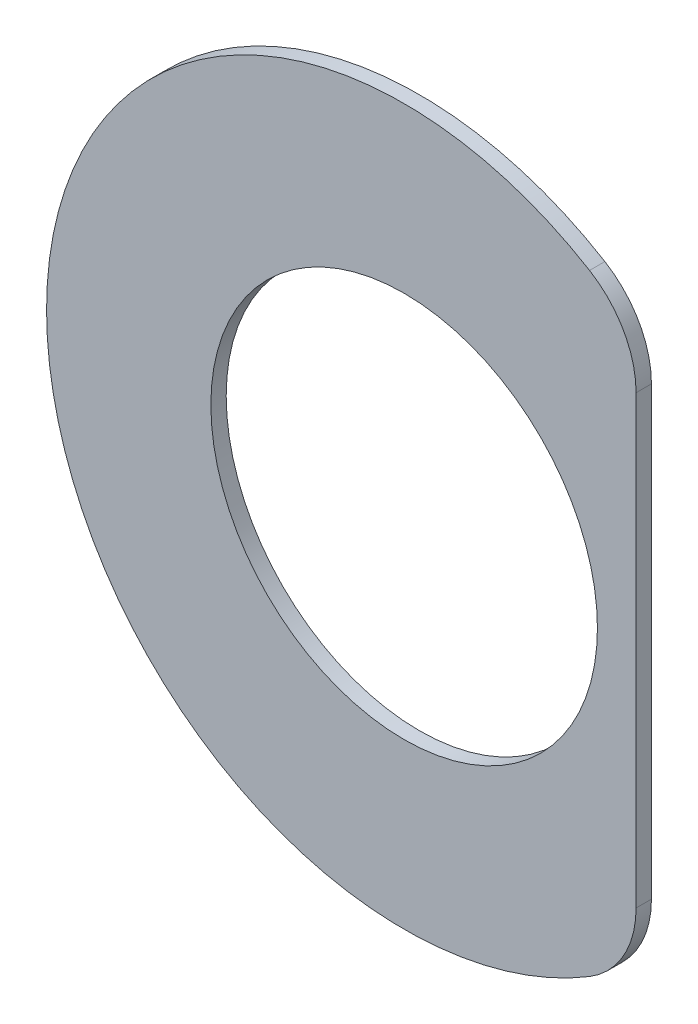
from build123d import *

# Parameters (mm, degrees)
SKETCH1_R           = 18.5
SKETCH1_R_2         = 10
BOSS_EXTRUDE1_DEPTH = 0.79375
CUT_EXTRUDE3_DEPTH  = 27.174988807
FILLET1_R           = 5


with BuildPart() as part:
    # Sketch1 → Boss-Extrude1 (new body)
    with BuildSketch(Plane.XY):
        Circle(SKETCH1_R)
        Circle(SKETCH1_R_2, mode=Mode.SUBTRACT)
    extrude(amount=BOSS_EXTRUDE1_DEPTH)

    # Sketch1<3> → Cut-Extrude3 (cut, through all)
    with BuildSketch(Plane.XY):
        with BuildLine():
            ThreePointArc((18.5, 0), (16.796577032, 7.75403121), (12, 14.08012784))
            Line((12, 14.08012784), (12, -14.08012784))
            ThreePointArc((12, -14.08012784), (16.796577032, -7.75403121), (18.5, 0))
        make_face()
    extrude(amount=CUT_EXTRUDE3_DEPTH, mode=Mode.SUBTRACT)

    # Fillet1
    fillet1_edges = [part.edges().sort_by_distance(p)[0] for p in [
        (12, -14.08012784, 0.396875),
        (12, 14.08012784, 0.396875),
    ]]
    fillet(fillet1_edges, radius=FILLET1_R)


solid = part.part
